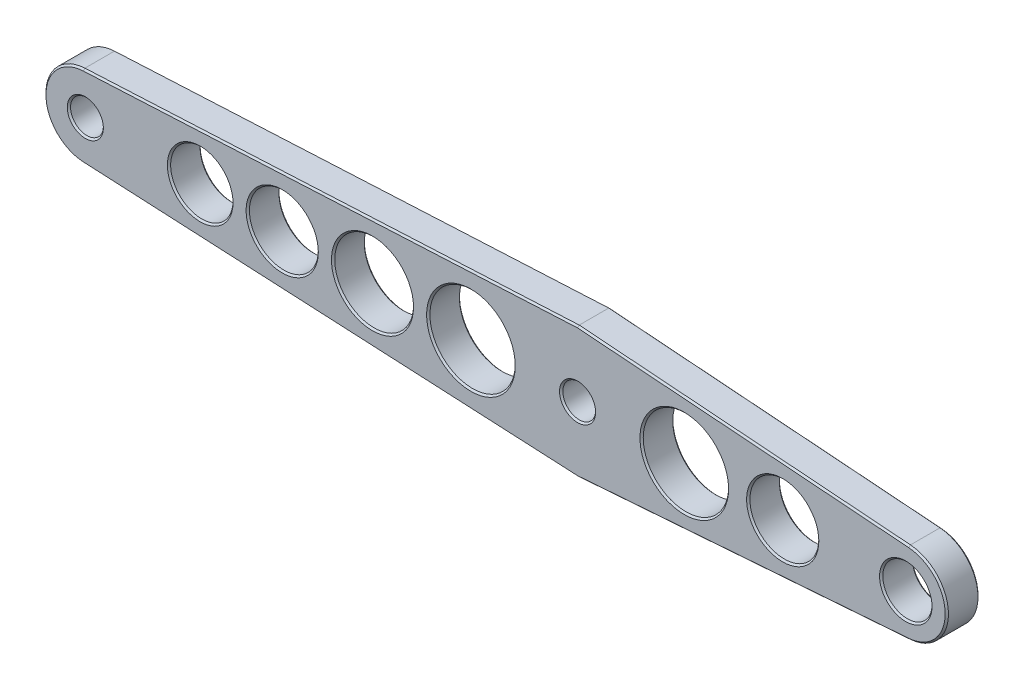
from build123d import *

# Parameters (mm, degrees)
SKETCH1_R           = 1
SKETCH1_R_2         = 1.5
SKETCH1_R_3         = 2.6
SKETCH1_R_4         = 2.1
SKETCH1_R_5         = 1.9
SKETCH1_R_6         = 2.4
BOSS_EXTRUDE1_DEPTH = 1
CHAMFER1_SIZE       = 0.1


with BuildPart() as part:
    # Sketch1 → Boss-Extrude1 (new, symmetric)
    with BuildSketch(Plane.XY):
        with BuildLine():
            Line((0, 4), (-30.124585833, 2.496893744))
            ThreePointArc((-30.124585833, 2.496893744), (-32.5, 0), (-30.124585833, -2.496893744))
            Line((-30.124585833, -2.496893744), (0, -4))
            Line((0, -4), (20.18611256, -2.493062798))
            ThreePointArc((20.18611256, -2.493062798), (22.5, 0), (20.18611256, 2.493062798))
            Line((20.18611256, 2.493062798), (0, 4))
        make_face()
        with Locations((-30, 0)):
            Circle(SKETCH1_R, mode=Mode.SUBTRACT)
        Circle(SKETCH1_R, mode=Mode.SUBTRACT)
        with Locations((20, 0)):
            Circle(SKETCH1_R_2, mode=Mode.SUBTRACT)
        with Locations((6.5, 0)):
            Circle(SKETCH1_R_3, mode=Mode.SUBTRACT)
        with Locations((12.5, 0)):
            Circle(SKETCH1_R_4, mode=Mode.SUBTRACT)
        with Locations((-23, 0)):
            Circle(SKETCH1_R_5, mode=Mode.SUBTRACT)
        with Locations((-18, 0)):
            Circle(SKETCH1_R_4, mode=Mode.SUBTRACT)
        with Locations((-12.5, 0)):
            Circle(SKETCH1_R_6, mode=Mode.SUBTRACT)
        with Locations((-6.5, 0)):
            Circle(SKETCH1_R_3, mode=Mode.SUBTRACT)
    extrude(amount=BOSS_EXTRUDE1_DEPTH, both=True)

    # Chamfer1
    chamfer1_edges = [part.edges().sort_by_distance(p)[0] for p in [
        (-32.5, 0, 1),
        (-15.062292916, -3.248446872, 1),
        (-31, 0, -1),
        (-31, 0, 1),
        (-1, 0, -1),
        (10.09305628, -3.246531399, 1),
        (-1, 0, 1),
        (18.5, 0, -1),
        (22.5, 0, 1),
        (18.5, 0, 1),
        (3.9, 0, -1),
        (3.9, 0, 1),
        (10.4, 0, -1),
        (10.4, 0, 1),
        (-24.9, 0, -1),
        (-24.9, 0, 1),
        (-20.1, 0, -1),
        (-20.1, 0, 1),
        (-14.9, 0, -1),
        (-14.9, 0, 1),
        (-9.1, 0, -1),
        (-9.1, 0, 1),
        (10.09305628, 3.246531399, 1),
        (22.5, 0, -1),
        (10.09305628, -3.246531399, -1),
        (-15.062292916, -3.248446872, -1),
        (-32.5, 0, -1),
        (-15.062292916, 3.248446872, -1),
        (10.09305628, 3.246531399, -1),
        (-15.062292916, 3.248446872, 1),
    ]]
    chamfer(chamfer1_edges, length=CHAMFER1_SIZE)


solid = part.part
